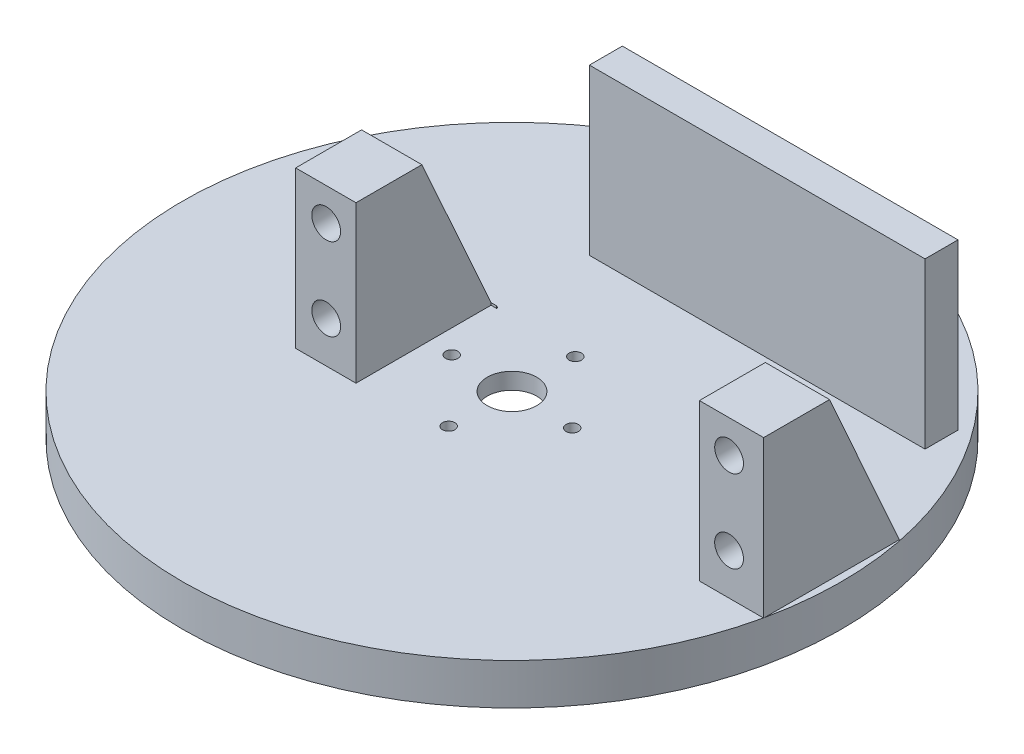
from build123d import *

# Parameters (mm, degrees)
SKIZZE1_R                       = 40
AUFSATZ_LINEAR_AUSTRAGEN1_DEPTH = 5
SKIZZE2_R                       = 10.75
SCHNITT_LINEAR_AUSTRAGEN1_DEPTH = 3
SKIZZE3_R                       = 3
SKIZZE3_R_2                     = 0.75
SCHNITT_LINEAR_AUSTRAGEN2_DEPTH = 13
SKIZZE4_W                       = 8
SKIZZE4_H                       = 8
AUFSATZ_LINEAR_AUSTRAGEN2_DEPTH = 18.97
AUFSATZ_LINEAR_AUSTRAGEN3_DEPTH = 8
AUFSATZ_LINEAR_AUSTRAGEN4_DEPTH = 8
SKIZZE7_R                       = 1.75
SCHNITT_LINEAR_AUSTRAGEN3_DEPTH = 33.27
SKIZZE9_W                       = 40.738044429
SKIZZE9_H                       = 4
AUFSATZ_LINEAR_AUSTRAGEN5_DEPTH = 20
SKIZZE10_R                      = 3
AUFSATZ_LINEAR_AUSTRAGEN6_DEPTH = 4
SKIZZE11_W                      = 0.727428481
SKIZZE11_H                      = 19.15
SKIZZE11_W_2                    = 0.206337284
SCHNITT_LINEAR_AUSTRAGEN4_DEPTH = 16.39


with BuildPart() as part:
    # Skizze1 → Aufsatz-Linear austragen1 (new body)
    with BuildSketch(Plane(origin=(0, 0, 0), x_dir=(1, 0, 0), z_dir=(0, 1, 0))):
        with Locations(Location((0, 0, 0), (0, 0, 270))):
            Circle(SKIZZE1_R)
    extrude(amount=AUFSATZ_LINEAR_AUSTRAGEN1_DEPTH)

    # Skizze2 → Schnitt-Linear austragen1 (cut)
    with BuildSketch(Plane.XZ):
        with Locations(Location((0, 0, 0), (0, 0, 270))):
            Circle(SKIZZE2_R)
    extrude(amount=-SCHNITT_LINEAR_AUSTRAGEN1_DEPTH, mode=Mode.SUBTRACT)

    # Skizze3 → Schnitt-Linear austragen2 (cut)
    with BuildSketch(Plane.XZ):
        with Locations(Location((0, 0, 0), (0, 0, 270))):
            Circle(SKIZZE3_R)
        with Locations(Location((-0.185951444, 7.49769445, 0), (0, 0, 270))):
            Circle(SKIZZE3_R_2)
        with Locations(Location((7.49769445, 0.185951444, 0), (0, 0, 270))):
            Circle(SKIZZE3_R_2)
        with Locations(Location((0.185951444, -7.49769445, 0), (0, 0, 270))):
            Circle(SKIZZE3_R_2)
        with Locations(Location((-7.49769445, -0.185951444, 0), (0, 0, 270))):
            Circle(SKIZZE3_R_2)
    extrude(amount=-SCHNITT_LINEAR_AUSTRAGEN2_DEPTH, mode=Mode.SUBTRACT)

    # Skizze4 → Aufsatz-Linear austragen2 (add)
    with BuildSketch(Plane(origin=(0, 5, 0), x_dir=(1, 0, 0), z_dir=(0, 1, 0))):
        with Locations((-13.649547585, -4.604184577)):
            Rectangle(SKIZZE4_W, SKIZZE4_H)
        with Locations((35.098787181, -4.555000776)):
            Rectangle(SKIZZE4_W, SKIZZE4_H)
    extrude(amount=AUFSATZ_LINEAR_AUSTRAGEN2_DEPTH)

    # Skizze5 → Aufsatz-Linear austragen3 (add)
    with BuildSketch(Plane(origin=(39.098787181, 0, 0), x_dir=(0, 0, -1), z_dir=(1, 0, 0))):
        Polygon((-0.555000776, 23.97), (7.911534589, 5), (-0.555000776, 5), align=None)
    extrude(amount=-AUFSATZ_LINEAR_AUSTRAGEN3_DEPTH)

    # Skizze6 → Aufsatz-Linear austragen4 (add)
    with BuildSketch(Plane.ZY.offset(17.649547585)):
        Polygon((0.604184577, 23.97), (-7.911534589, 5), (0.604184577, 5), align=None)
    extrude(amount=-AUFSATZ_LINEAR_AUSTRAGEN4_DEPTH)

    # Skizze7 → Schnitt-Linear austragen3 (cut)
    with BuildSketch(Plane.XY.offset(8.604184577)):
        with Locations((-13.944175516, 20)):
            Circle(SKIZZE7_R)
        with Locations((-13.944175516, 10)):
            Circle(SKIZZE7_R)
        with Locations(Location((34.90415925, 10, 0), (0, 0, 90))):
            Circle(SKIZZE7_R)
        with Locations(Location((34.908787181, 20, 0), (0, 0, 90))):
            Circle(SKIZZE7_R)
    extrude(amount=-SCHNITT_LINEAR_AUSTRAGEN3_DEPTH, mode=Mode.SUBTRACT)

    # Skizze9 → Aufsatz-Linear austragen5 (add)
    with BuildSketch(Plane(origin=(0, 5, 0), x_dir=(1, 0, 0), z_dir=(0, 1, 0))):
        with Locations((10.767809396, 20.99827279)):
            Rectangle(SKIZZE9_W, SKIZZE9_H)
    extrude(amount=AUFSATZ_LINEAR_AUSTRAGEN5_DEPTH)

    # Skizze10 → Aufsatz-Linear austragen6 (add)
    with BuildSketch(Plane(origin=(0, 0, -22.99827279), x_dir=(-1, 0, 0), z_dir=(0, 0, -1))):
        with Locations(Location((0.044175516, 15, 0), (0, 0, 180))):
            Circle(SKIZZE10_R)
    extrude(amount=AUFSATZ_LINEAR_AUSTRAGEN6_DEPTH)

    # Skizze11 → Schnitt-Linear austragen4 (cut)
    with BuildSketch(Plane.XY.offset(8.604184577)):
        with Locations((-9.96492706, 14.575)):
            Rectangle(SKIZZE11_W, SKIZZE11_H)
        with Locations((31.201955823, 14.575)):
            Rectangle(SKIZZE11_W_2, SKIZZE11_H)
    extrude(amount=-SCHNITT_LINEAR_AUSTRAGEN4_DEPTH, mode=Mode.SUBTRACT)


solid = part.part
